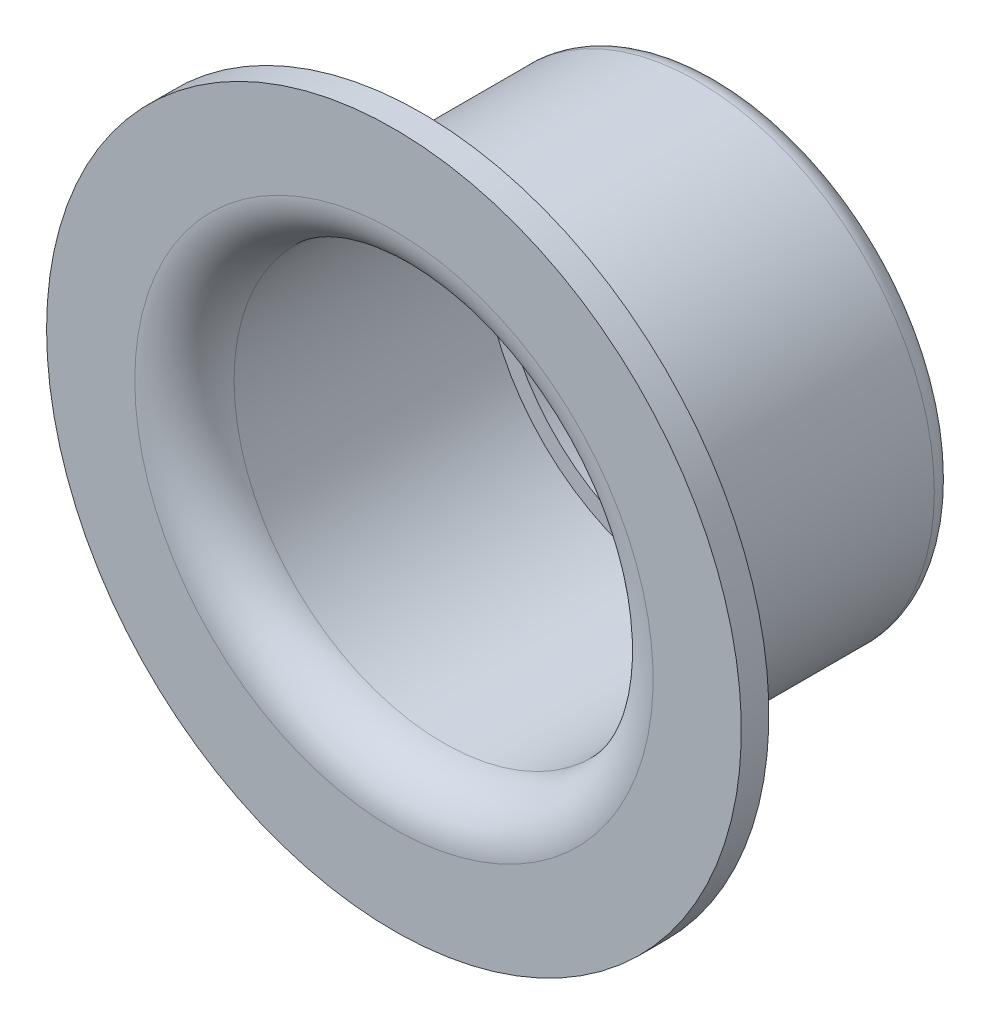
from build123d import *


with BuildPart() as part:
    # Sketch1 → Revolve1 (revolve)
    with BuildSketch(Plane(origin=(0, 0, 0), x_dir=(0, 0, -1), z_dir=(1, 0, 0)), mode=Mode.PRIVATE) as revolve1_sk:
        with BuildLine():
            Line((0, 17.4625), (0, 19.5))
            ThreePointArc((0, 19.5), (-0.585786438, 20.914213562), (-2, 21.5))
            Line((-2, 21.5), (-25, 21.5))
            ThreePointArc((-25, 21.5), (-26.414213562, 22.085786438), (-27, 23.5))
            Line((-27, 23.5), (-27, 31.5))
            Line((-27, 31.5), (-29.5, 31.5))
            Line((-29.5, 31.5), (-29.5, 23.5))
            ThreePointArc((-29.5, 23.5), (-28.181980515, 20.318019485), (-25, 19))
            Line((-25, 19), (-2.5, 19))
            Line((-2.5, 19), (-2.5, 17.4625))
            Line((-2.5, 17.4625), (0, 17.4625))
        make_face()
    revolve(revolve1_sk.sketch.rotate(Axis((0, 0, 0), (0, 0, 1)), 90), axis=Axis((0, 0, 0), (0, 0, 1)))


solid = part.part
